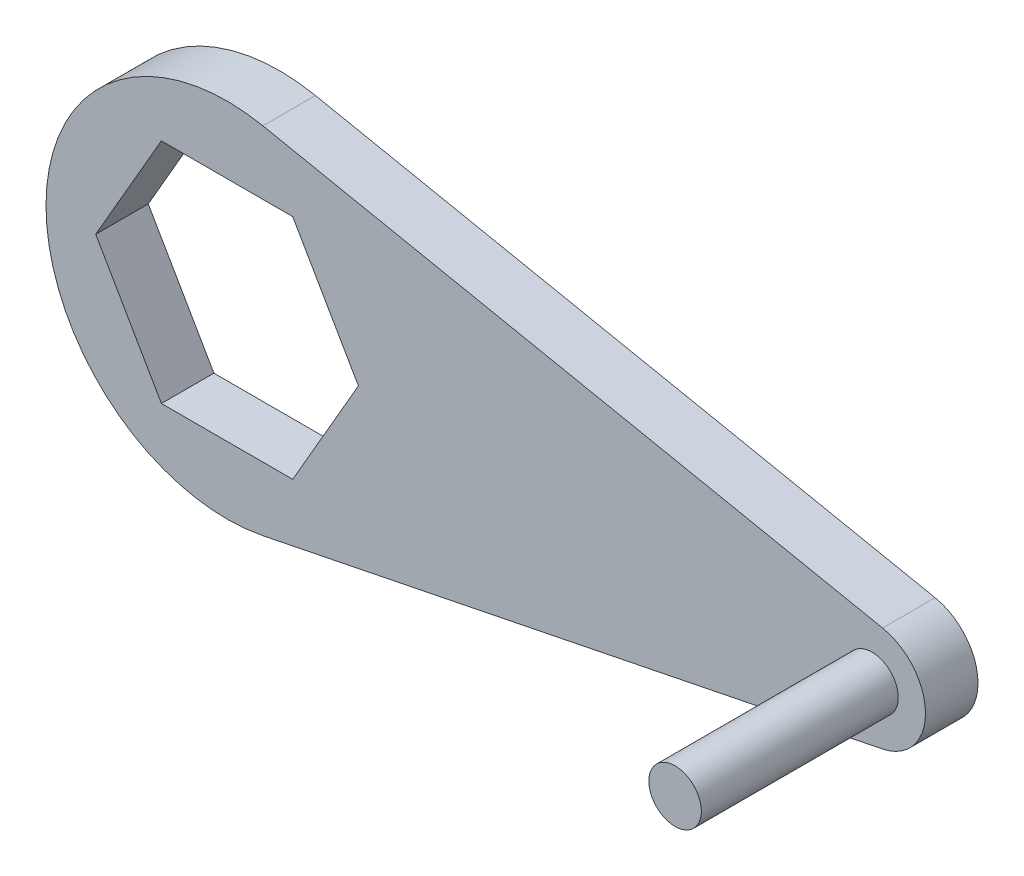
from build123d import *

# Parameters (mm, degrees)
BOSS_EXTRUDE1_DEPTH = 5.08
SKETCH2_R           = 2.54
BOSS_EXTRUDE2_DEPTH = 19.05


with BuildPart() as part:
    # Sketch1 → Boss-Extrude1 (new body)
    with BuildSketch(Plane.XY):
        with BuildLine():
            Line((3.465176556, 17.167746033), (63.408488693, 5.068652798))
            ThreePointArc((63.408488693, 5.068652798), (67.556291682, 0), (63.408488693, -5.068652798))
            Line((63.408488693, -5.068652798), (3.465176556, -17.167746033))
            ThreePointArc((3.465176556, -17.167746033), (-17.513964497, 0), (3.465176556, 17.167746033))
        make_face()
        Polygon((12.70363461, 0), (6.351817305, 11.001670293), (-6.351817305, 11.001670293), (-12.70363461, 0), (-6.351817305, -11.001670293), (6.351817305, -11.001670293), align=None, mode=Mode.SUBTRACT)
    extrude(amount=BOSS_EXTRUDE1_DEPTH)

    # Sketch2 → Boss-Extrude2 (add)
    with BuildSketch(Plane.XY.offset(5.08)):
        with Locations(Location((62.385420387, 0, 0), (0, 0, 180))):
            Circle(SKETCH2_R)
    extrude(amount=BOSS_EXTRUDE2_DEPTH)


solid = part.part
